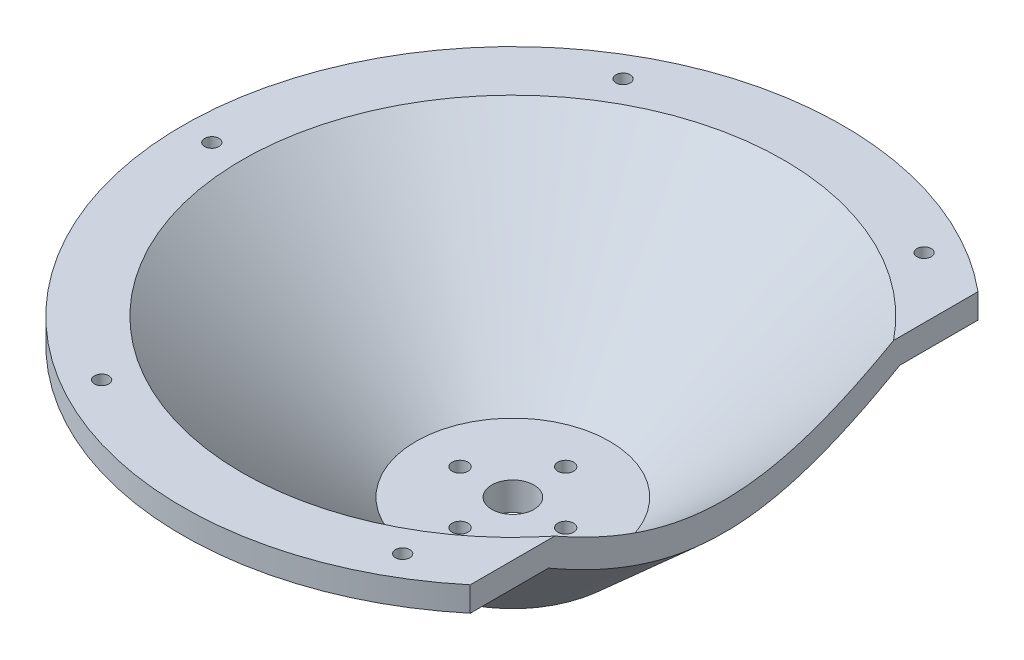
from build123d import *

# Parameters (mm, degrees)
SKETCH1_R                                      = 27.5
BOSS_EXTRUDE1_DEPTH                            = 8
M4_CLEARANCE_HOLE1_D                           = 4.5
CIRPATTERN1_COUNT                              = 4
SKETCH11_R                                     = 6
CUT_EXTRUDE1_DEPTH                             = 143.673807756
CSK_FOR_6_FLAT_HEAD_MACHINE_SCREW1_D           = 4.064
CSK_FOR_6_FLAT_HEAD_MACHINE_SCREW1_CSINK_D     = 7.366
CSK_FOR_6_FLAT_HEAD_MACHINE_SCREW1_CSINK_ANGLE = 82
CIRPATTERN2_COUNT                              = 6


with BuildPart() as part:
    # Sketch1 → Boss-Extrude1 (new body)
    with BuildSketch(Plane(origin=(0, 0, 0), x_dir=(1, 0, 0), z_dir=(0, 1, 0))):
        with Locations(Location((0, 0, 0), (0, 0, 270))):
            Circle(SKETCH1_R)
    extrude(amount=BOSS_EXTRUDE1_DEPTH)

    # M4 Clearance Hole1 (through all)
    with Locations(Plane(origin=(0, 8, 0), x_dir=(1, 0, 0), z_dir=(0, 1, 0))):
        with Locations((0, 15)):
            m4_clearance_hole1 = Hole(M4_CLEARANCE_HOLE1_D / 2)

    # CirPattern1: M4 Clearance Hole1 ×4 about axis
    cirpattern1_axis = Axis((0, 0, 0), (0, 1, 0))
    for i in range(1, CIRPATTERN1_COUNT):
        add(m4_clearance_hole1.rotate(cirpattern1_axis, i * 360 / CIRPATTERN1_COUNT), mode=Mode.SUBTRACT)

    # Sketch6 → Revolve1 (revolve)
    with BuildSketch(Plane.XY, mode=Mode.PRIVATE) as revolve1_sk:
        Polygon((76.92225691, 52.5), (27.5, 8), (17.5, 8), (17.5, 0), (27.5, 0), (85.807157029, 52.5), align=None)
        Polygon((85.807157029, 52.5), (78.032869425, 45.5), (93.807157029, 45.5), (93.807157029, 52.5), align=None)
    revolve(revolve1_sk.sketch.rotate(Axis((0, 8, 0), (0, -1, 0)), 90), axis=Axis((0, 8, 0), (0, -1, 0)))

    # Sketch11 → Cut-Extrude1 (cut, through all)
    with BuildSketch(Plane.XZ):
        with Locations(Location((0, 0, 0), (0, 0, 270))):
            Circle(SKETCH11_R)
    extrude(amount=-CUT_EXTRUDE1_DEPTH, mode=Mode.SUBTRACT)

    # CSK for #6 Flat Head Machine Screw1 (through all)
    with Locations(Plane.XZ.offset(-45.5)):
        with Locations((85.5, 0)):
            csk_for_6_flat_head_machine_screw1 = CounterSinkHole(CSK_FOR_6_FLAT_HEAD_MACHINE_SCREW1_D / 2, CSK_FOR_6_FLAT_HEAD_MACHINE_SCREW1_CSINK_D / 2, counter_sink_angle=CSK_FOR_6_FLAT_HEAD_MACHINE_SCREW1_CSINK_ANGLE)

    # CirPattern2: CSK for #6 Flat Head Machine Screw1 ×6 about axis
    cirpattern2_axis = Axis((0, 0, 0), (0, 1, 0))
    for i in range(1, CIRPATTERN2_COUNT):
        add(csk_for_6_flat_head_machine_screw1.rotate(cirpattern2_axis, i * 360 / CIRPATTERN2_COUNT), mode=Mode.SUBTRACT)

    # Split1
    split(bisect_by=Plane(origin=(60, 0, 0), x_dir=(0, 0, 1), z_dir=(1, 0, 0)), keep=Keep.BOTTOM)


solid = part.part
